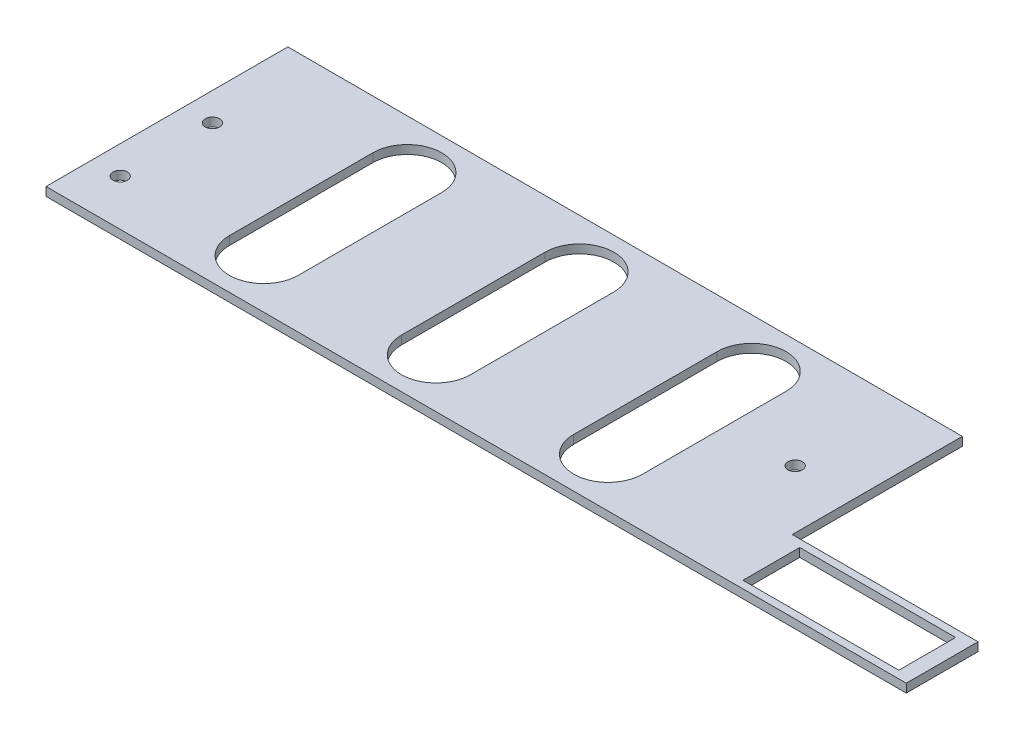
from build123d import *

# Parameters (mm, degrees)
ESQUISSE1_R             = 2.5
BOSS_EXTRU_1_DEPTH      = 3
ENL_V_MAT_EXTRU_1_DEPTH = 166.064843505
SKETCH1_W               = 235.08624341
SKETCH1_H               = 3
BOSS_EXTRUDE1_DEPTH     = 20
SKETCH2_W               = 54.316544192
SKETCH2_H               = 19.777044638
CUT_EXTRUDE1_DEPTH      = 10
CUT_EXTRUDE2_DEPTH      = 10


with BuildPart() as part:
    # Esquisse1 → Boss.-Extru.1 (new body)
    with BuildSketch(Plane(origin=(0, 0, 0), x_dir=(1, 0, 0), z_dir=(0, 1, 0))):
        Polygon((-161.174292495, 18.77), (-161.174292495, -25.5), (-161.174292495, -35.5), (138.625707505, -35.5), (138.625707505, -10.5), (73.911950915, -10.5), (73.911950915, 28.77), (-161.174292495, 28.77), align=None)
        with Locations(Location((-151.374292495, -19.4325, 0), (0, 0, 270))):
            Circle(ESQUISSE1_R, mode=Mode.SUBTRACT)
        with Locations(Location((-151.374292495, 12.7025, 0), (0, 0, 270))):
            Circle(ESQUISSE1_R, mode=Mode.SUBTRACT)
        with Locations(Location((53.661950915, 10.747499922, 0), (0, 0, 270))):
            Circle(ESQUISSE1_R, mode=Mode.SUBTRACT)
        Polygon((114.261515644, -15.687745544), (114.261515644, -18.634239014), (132.625707505, -18.634239014), (132.625707505, -32.887044638), (114.261515644, -32.887044638), (79.109163313, -32.887044638), (79.109163313, -15.687745544), align=None, mode=Mode.SUBTRACT)
    extrude(amount=BOSS_EXTRU_1_DEPTH)

    # Esquisse2 → Enlèv. mat.-Extru.1 (cut, through all)
    with BuildSketch(Plane.XZ):
        with BuildLine():
            Line((7.640390062, -11.635), (7.640390062, 18.365))
            ThreePointArc((7.640390062, 18.365), (15.140390062, 25.865), (22.640390062, 18.365))
            Line((22.640390062, 18.365), (22.640390062, -11.635))
            ThreePointArc((22.640390062, -11.635), (15.140390062, -19.135), (7.640390062, -11.635))
        make_face()
        with BuildLine():
            Line((-51.13117079, -11.635), (-51.13117079, 18.365))
            ThreePointArc((-51.13117079, 18.365), (-43.63117079, 25.865), (-36.13117079, 18.365))
            Line((-36.13117079, 18.365), (-36.13117079, -11.635))
            ThreePointArc((-36.13117079, -11.635), (-43.63117079, -19.135), (-51.13117079, -11.635))
        make_face()
        with BuildLine():
            Line((-109.902731643, -11.635), (-109.902731643, 18.365))
            ThreePointArc((-109.902731643, 18.365), (-102.402731643, 25.865), (-94.902731643, 18.365))
            Line((-94.902731643, 18.365), (-94.902731643, -11.635))
            ThreePointArc((-94.902731643, -11.635), (-102.402731643, -19.135), (-109.902731643, -11.635))
        make_face()
    extrude(amount=-ENL_V_MAT_EXTRU_1_DEPTH, mode=Mode.SUBTRACT)

    # Sketch1 → Boss-Extrude1 (add)
    with BuildSketch(Plane(origin=(0, 0, -28.77), x_dir=(-1, 0, 0), z_dir=(0, 0, -1))):
        with Locations((43.63117079, 1.5)):
            Rectangle(SKETCH1_W, SKETCH1_H)
    extrude(amount=BOSS_EXTRUDE1_DEPTH)

    # Sketch2 → Cut-Extrude1 (cut)
    with BuildSketch(Plane.XZ):
        with Locations((106.267435409, 22.998522319)):
            Rectangle(SKETCH2_W, SKETCH2_H)
    extrude(amount=-CUT_EXTRUDE1_DEPTH, mode=Mode.SUBTRACT)

    # Sketch3 → Cut-Extrude2 (cut)
    with BuildSketch(Plane(origin=(0, 0, 0), x_dir=(-1, 0, 0), z_dir=(0, -1, 0))):
        with BuildLine():
            Line((90.402731643, -18.365), (90.402731643, 31.635))
            ThreePointArc((90.402731643, 31.635), (102.402731643, 43.635), (114.402731643, 31.635))
            Line((114.402731643, 31.635), (114.402731643, -18.365))
            ThreePointArc((114.402731643, -18.365), (102.402731643, -30.365), (90.402731643, -18.365))
        make_face()
        with BuildLine():
            Line((30.402731643, -18.365), (30.402731643, 31.635))
            ThreePointArc((30.402731643, 31.635), (42.402731643, 43.635), (54.402731643, 31.635))
            Line((54.402731643, 31.635), (54.402731643, -18.365))
            ThreePointArc((54.402731643, -18.365), (42.402731643, -30.365), (30.402731643, -18.365))
        make_face()
        with BuildLine():
            Line((-29.597268357, -18.365), (-29.597268357, 31.635))
            ThreePointArc((-29.597268357, 31.635), (-17.597268357, 43.635), (-5.597268357, 31.635))
            Line((-5.597268357, 31.635), (-5.597268357, -18.365))
            ThreePointArc((-5.597268357, -18.365), (-17.597268357, -30.365), (-29.597268357, -18.365))
        make_face()
    extrude(amount=-CUT_EXTRUDE2_DEPTH, mode=Mode.SUBTRACT)


solid = part.part
